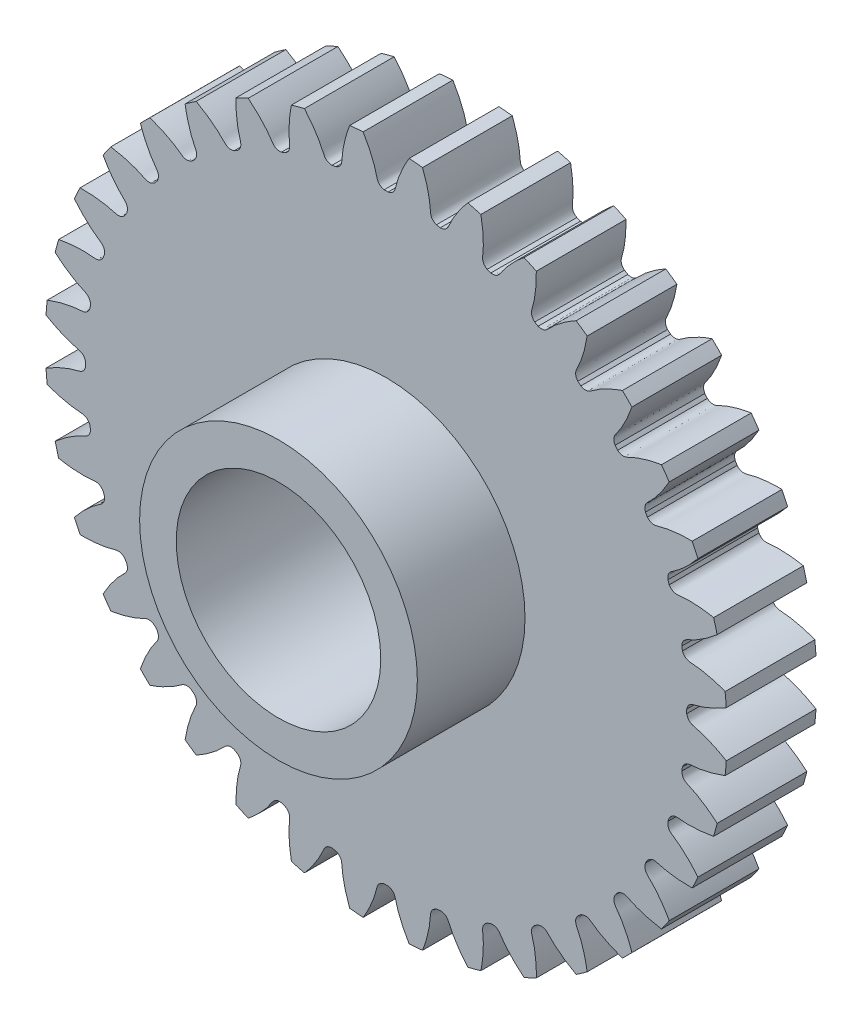
from build123d import *

# Parameters (mm, degrees)
SKETCH_1_R               = 9.5
EXTRUDE_1_DEPTH          = 2.5
CUT_EXTRUDE_1_DEPTH      = 14.665650369
PATTERN_CIRCULAR_1_COUNT = 36
SKETCH_4_R               = 3.87
EXTRUDE_2_DEPTH          = 5.5
CUT_EXTRUDE_2_REACH      = 16.489
SKETCH_5_R               = 2.85


with BuildPart() as part:
    # 草图1 → 凸台-拉伸1 (new body)
    with BuildSketch(Plane.XY):
        Circle(SKETCH_1_R)
    extrude(amount=EXTRUDE_1_DEPTH)

    # 草图2 → 切除-拉伸1 (cut, through all)
    with BuildSketch(Plane.XY):
        with BuildLine():
            ThreePointArc((0.054934474, 8.374819831), (0, 8.375), (-0.054934474, 8.374819831))
            add(Edge.make_bspline(
                [(-0.054934474, 8.374819831), (-0.234978953, 8.415201319), (-0.250497423, 8.549314662), (-0.288218357, 8.691373568), (-0.299748628, 8.731851177), (-0.31309989, 8.775314366), (-0.328367396, 8.821718829), (-0.34568221, 8.870999935), (-0.365162519, 8.923094297), (-0.386928046, 8.977933385), (-0.411095645, 9.035445483), (-0.437780475, 9.09555517), (-0.467095531, 9.15818354), (-0.499151661, 9.223248205), (-0.534057436, 9.290663368), (-0.571919068, 9.360339873), (-0.612840323, 9.432185269), (-0.656922424, 9.506103874), (-0.704263969, 9.581996838), (-0.754960844, 9.659762209), (-0.809106137, 9.739295006), (-0.866790057, 9.820487287), (-0.928099853, 9.903228226), (-0.993119734, 9.987404187), (-1.061930793, 10.072898798), (-1.134610932, 10.15959304), (-1.211234787, 10.247365317), (-1.291873657, 10.33609155), (-1.376595441, 10.425645255), (-1.46546454, 10.515897632), (-1.591181957, 10.63856609), (-1.689482035, 10.72881939), (-1.757006718, 10.78843362)],
                knots=[0, 0, 0, 0, 0.120371484, 0.133302531, 0.147363917, 0.16255564, 0.178877702, 0.196330101, 0.214912839, 0.234625915, 0.25546933, 0.277443082, 0.300547173, 0.324781601, 0.350146368, 0.376641473, 0.404266917, 0.433022698, 0.462908818, 0.493925275, 0.526072071, 0.559349205, 0.593756678, 0.629294488, 0.665962637, 0.703761124, 0.742689949, 0.782749112, 0.823938613, 0.866258453, 0.90970863, 1, 1, 1, 1], degree=3))
            ThreePointArc((-1.757006718, 10.78843362), (0, 10.930570551), (1.757006718, 10.78843362))
            add(Edge.make_bspline(
                [(0.054934474, 8.374819831), (0.234978953, 8.415201319), (0.250497423, 8.549314662), (0.288218357, 8.691373568), (0.299748628, 8.731851177), (0.31309989, 8.775314366), (0.328367396, 8.821718829), (0.34568221, 8.870999935), (0.365162519, 8.923094297), (0.386928046, 8.977933385), (0.411095645, 9.035445483), (0.437780475, 9.09555517), (0.467095531, 9.15818354), (0.499151661, 9.223248205), (0.534057436, 9.290663368), (0.571919068, 9.360339873), (0.612840323, 9.432185269), (0.656922424, 9.506103874), (0.704263969, 9.581996838), (0.754960844, 9.659762209), (0.809106137, 9.739295006), (0.866790057, 9.820487287), (0.928099853, 9.903228226), (0.993119734, 9.987404187), (1.061930793, 10.072898798), (1.134610932, 10.15959304), (1.211234787, 10.247365317), (1.291873657, 10.33609155), (1.376595441, 10.425645255), (1.46546454, 10.515897632), (1.591181957, 10.63856609), (1.689482035, 10.72881939), (1.757006718, 10.78843362)],
                knots=[0, 0, 0, 0, 0.120371484, 0.133302531, 0.147363917, 0.16255564, 0.178877702, 0.196330101, 0.214912839, 0.234625915, 0.25546933, 0.277443082, 0.300547173, 0.324781601, 0.350146368, 0.376641473, 0.404266917, 0.433022698, 0.462908818, 0.493925275, 0.526072071, 0.559349205, 0.593756678, 0.629294488, 0.665962637, 0.703761124, 0.742689949, 0.782749112, 0.823938613, 0.866258453, 0.90970863, 1, 1, 1, 1], degree=3))
        make_face()
    cut_extrude_1 = extrude(amount=CUT_EXTRUDE_1_DEPTH, mode=Mode.SUBTRACT)

    # 阵列(圆周)1: 切除-拉伸1 ×36 about axis
    pattern_circular_1_axis = Axis((0, 0, 2.5), (0, 0, -1))
    for i in range(1, PATTERN_CIRCULAR_1_COUNT):
        add(cut_extrude_1.rotate(pattern_circular_1_axis, i * 360 / PATTERN_CIRCULAR_1_COUNT), mode=Mode.SUBTRACT)

    # 草图4 → 凸台-拉伸2 (add)
    with BuildSketch(Plane(origin=(0, 0, 0), x_dir=(-1, 0, 0), z_dir=(0, 0, -1))):
        with Locations(Location((0, 0, 0), (0, 0, 180))):
            Circle(SKETCH_4_R)
    extrude(amount=-EXTRUDE_2_DEPTH)

    # 草图5 → 切除-拉伸2 (cut, up to next)
    with BuildSketch(Plane.XY.offset(5.5), mode=Mode.PRIVATE) as cut_extrude_2_sk1:
        Circle(SKETCH_5_R)
    cut_extrude_2_tool1 = extrude(cut_extrude_2_sk1.sketch, amount=-CUT_EXTRUDE_2_REACH, mode=Mode.PRIVATE) & part.part
    add(cut_extrude_2_tool1.solids().sort_by_distance((0, 0, 5.5))[0], mode=Mode.SUBTRACT)


solid = part.part
